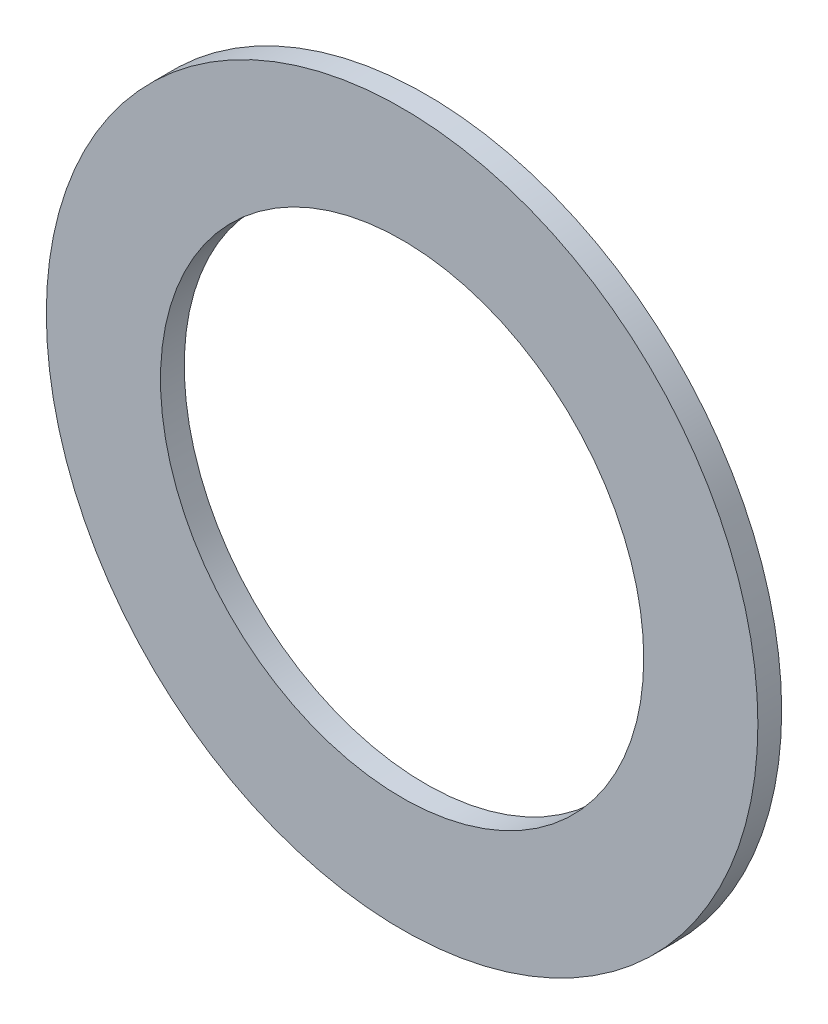
from build123d import *

# Parameters (mm, degrees)
SKETCH1_R           = 23.749
BOSS_EXTRUDE1_DEPTH = 1.5875
SKETCH2_R           = 16.129
CUT_EXTRUDE1_DEPTH  = 34.623654743


with BuildPart() as part:
    # Sketch1 → Boss-Extrude1 (new body)
    with BuildSketch(Plane.XY):
        Circle(SKETCH1_R)
    extrude(amount=BOSS_EXTRUDE1_DEPTH)

    # Sketch2 → Cut-Extrude1 (cut, through all)
    with BuildSketch(Plane.XY.offset(1.5875)):
        Circle(SKETCH2_R)
    extrude(amount=-CUT_EXTRUDE1_DEPTH, mode=Mode.SUBTRACT)


solid = part.part
